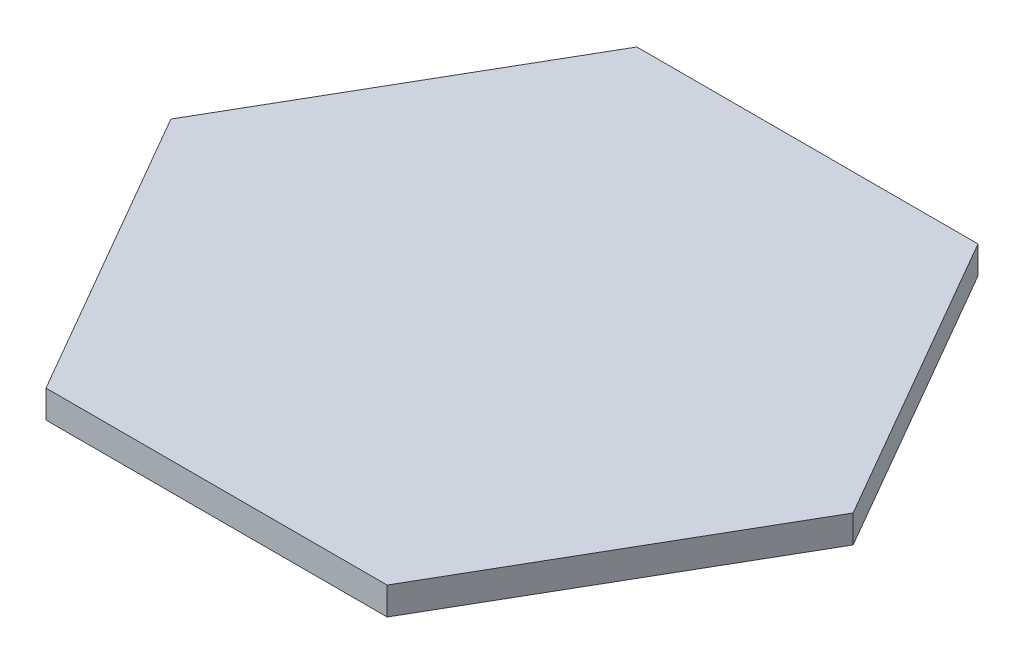
from build123d import *

# Parameters (mm, degrees)
BOSS_EXTRUDE1_DEPTH = 19.05


with BuildPart() as part:
    # Sketch1 → Boss-Extrude1 (new body)
    with BuildSketch(Plane(origin=(0, 0, 0), x_dir=(1, 0, 0), z_dir=(0, 1, 0))):
        Polygon((-234.635149399, 0), (-117.317574699, -203.2), (117.317574699, -203.2), (234.635149399, 0), (117.317574699, 203.2), (-117.317574699, 203.2), align=None)
    extrude(amount=BOSS_EXTRUDE1_DEPTH)


solid = part.part
